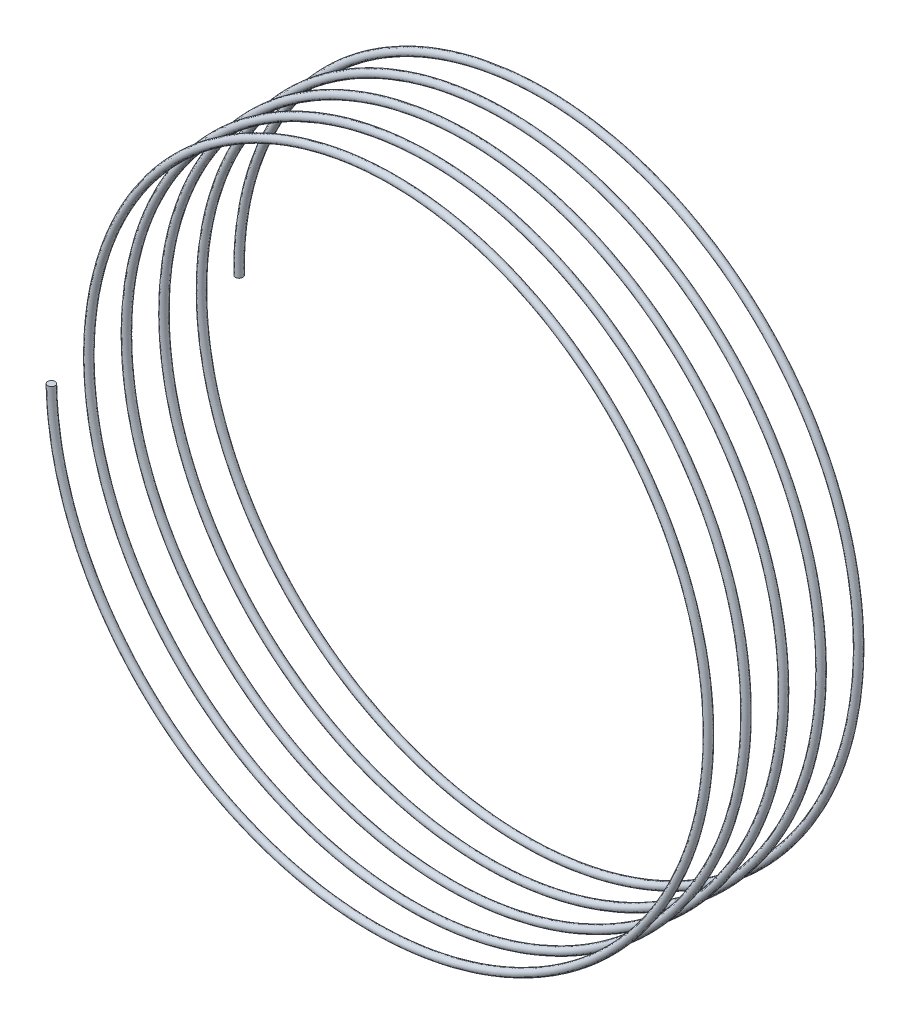
from build123d import *

# Parameters (mm, degrees)
VARREDURA1_PITCH       = 1
VARREDURA1_HEIGHT      = 5
VARREDURA1_RADIUS      = 8.5
VARREDURA1_START_ANGLE = -180
ESBO_O6_R              = 0.1


with BuildPart() as part:
    # Varredura1: sweep along a helix
    with BuildLine() as varredura1_path:
        add(Helix(VARREDURA1_PITCH, VARREDURA1_HEIGHT, VARREDURA1_RADIUS, center=(0, 0, 0), direction=(0, 0, 1), lefthand=True, mode=Mode.PRIVATE).rotate(Axis((0, 0, 0), (0, 0, 1)), VARREDURA1_START_ANGLE))
    # Esboço6 → Varredura1 (sweep)
    with BuildSketch(Plane(origin=(0, 0, 0), x_dir=(1, 0, 0), z_dir=(0, 1, 0))):
        with Locations((-8.5, 0)):
            Circle(ESBO_O6_R)
    sweep(path=varredura1_path.line, is_frenet=True)


solid = part.part
